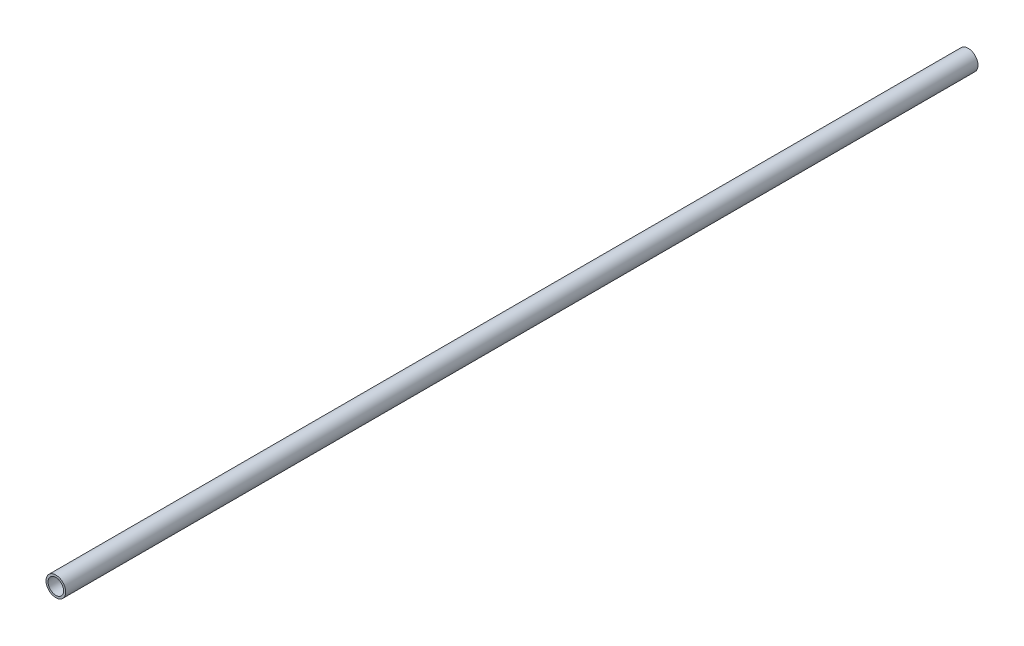
from build123d import *

# Parameters (mm, degrees)
SKETCH1_R           = 12.065
SKETCH1_R_2         = 9.525
BOSS_EXTRUDE1_DEPTH = 558.8


with BuildPart() as part:
    # Sketch1 → Boss-Extrude1 (new, symmetric)
    with BuildSketch(Plane.XY):
        Circle(SKETCH1_R)
        Circle(SKETCH1_R_2, mode=Mode.SUBTRACT)
    extrude(amount=BOSS_EXTRUDE1_DEPTH, both=True)


solid = part.part
